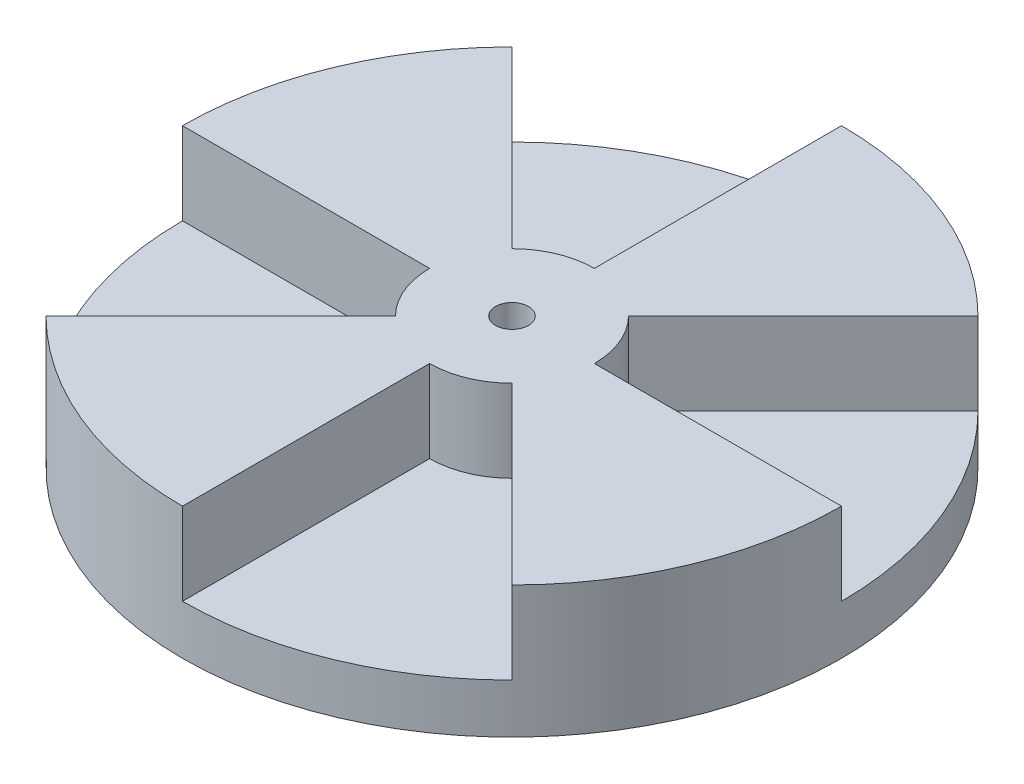
from build123d import *

# Parameters (mm, degrees)
SKETCH1_R                             = 20
EXTRUDE_MECHANISM_PART_2_DEPTH        = 8
CUT_START                             = -5
CUT_MECHANSIM_PART_2_DEPTH            = 5
SKETCH3_R                             = 1
HOLE_FOR_SCREW_MECHANSIM_PART_2_DEPTH = 10


with BuildPart() as part:
    # Sketch1 → Extrude (Mechanism Part 2) (new body)
    with BuildSketch(Plane(origin=(0, 0, 0), x_dir=(1, 0, 0), z_dir=(0, 1, 0))):
        with Locations(Location((0, 0, 0), (0, 0, 270))):
            Circle(SKETCH1_R)
    extrude(amount=EXTRUDE_MECHANISM_PART_2_DEPTH)

    # Sketch2 → Cut (Mechansim Part 2) (cut)
    with BuildSketch(Plane(origin=(0, 8, 0), x_dir=(1, 0, 0), z_dir=(0, 1, 0)).offset(CUT_START)):
        with BuildLine():
            ThreePointArc((-3.535533906, 3.535533906), (-1.913417162, 4.619397663), (0, 5))
            Line((0, 5), (0, 20))
            ThreePointArc((0, 20), (-7.653668647, 18.47759065), (-14.142135624, 14.142135624))
            Line((-14.142135624, 14.142135624), (-3.535533906, 3.535533906))
        make_face()
        with BuildLine():
            ThreePointArc((-3.535533906, -3.535533906), (-4.619397663, -1.913417162), (-5, 0))
            Line((-5, 0), (-20, 0))
            ThreePointArc((-20, 0), (-18.47759065, -7.653668647), (-14.142135624, -14.142135624))
            Line((-14.142135624, -14.142135624), (-3.535533906, -3.535533906))
        make_face()
        with BuildLine():
            ThreePointArc((3.535533906, -3.535533906), (1.913417162, -4.619397663), (0, -5))
            Line((0, -5), (0, -20))
            ThreePointArc((0, -20), (7.653668647, -18.47759065), (14.142135624, -14.142135624))
            Line((14.142135624, -14.142135624), (3.535533906, -3.535533906))
        make_face()
        with BuildLine():
            ThreePointArc((3.535533906, 3.535533906), (4.619397663, 1.913417162), (5, 0))
            Line((5, 0), (20, 0))
            ThreePointArc((20, 0), (18.47759065, 7.653668647), (14.142135624, 14.142135624))
            Line((14.142135624, 14.142135624), (3.535533906, 3.535533906))
        make_face()
    extrude(amount=CUT_MECHANSIM_PART_2_DEPTH, mode=Mode.SUBTRACT)

    # Sketch3 → Hole for Screw (Mechansim Part 2) (cut)
    with BuildSketch(Plane(origin=(0, 8, 0), x_dir=(1, 0, 0), z_dir=(0, 1, 0))):
        with Locations(Location((0, 0, 0), (0, 0, 270))):
            Circle(SKETCH3_R)
    extrude(amount=-HOLE_FOR_SCREW_MECHANSIM_PART_2_DEPTH, mode=Mode.SUBTRACT)


solid = part.part
